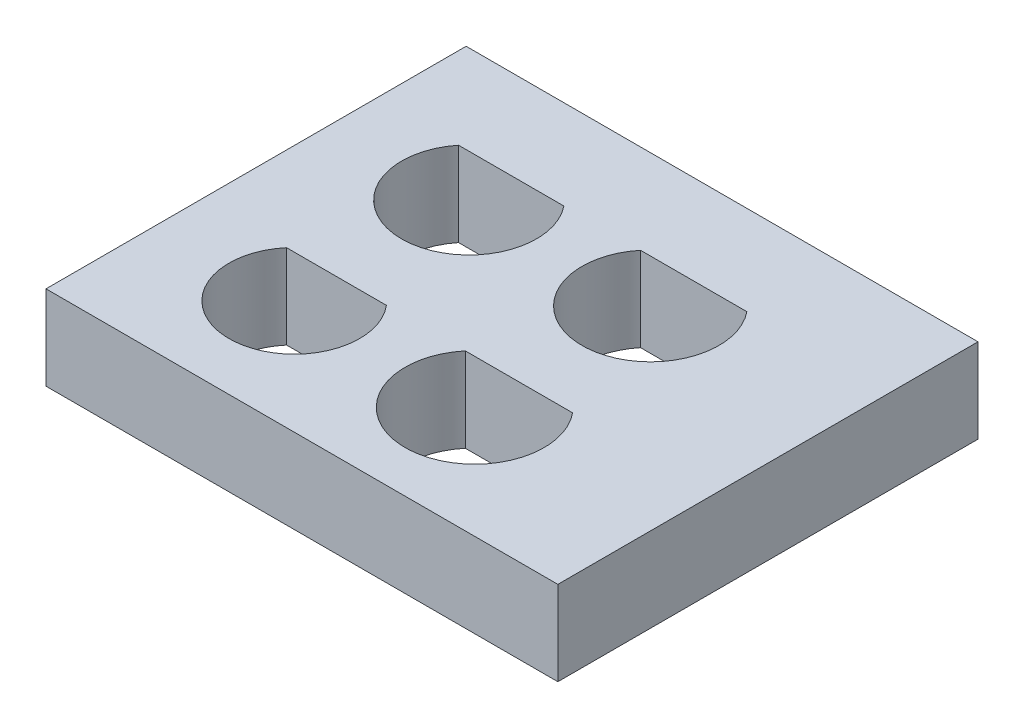
from build123d import *

# Parameters (mm, degrees)
SKETCH1_W           = 12.136372274
SKETCH1_H           = 9.961646607
BOSS_EXTRUDE2_DEPTH = 2


with BuildPart() as part:
    # Sketch1 → Boss-Extrude2 (new body)
    with BuildSketch(Plane(origin=(0, 0, 0), x_dir=(1, 0, 0), z_dir=(0, 1, 0))):
        with Locations((2.877549337, 2.284027555)):
            Rectangle(SKETCH1_W, SKETCH1_H)
        with BuildLine():
            Line((-1.184271928, 1), (1.184271928, 1))
            ThreePointArc((1.184271928, 1), (0, -1.55), (-1.184271928, 1))
        make_face(mode=Mode.SUBTRACT)
        with BuildLine():
            Line((3.05341377, 1), (5.598998182, 1))
            ThreePointArc((5.598998182, 1), (4.326205976, -1.7), (3.05341377, 1))
        make_face(mode=Mode.SUBTRACT)
        with BuildLine():
            Line((-1.2489996, 5.143134086), (1.2489996, 5.143134086))
            ThreePointArc((1.2489996, 5.143134086), (0, 2.543134086), (-1.2489996, 5.143134086))
        make_face(mode=Mode.SUBTRACT)
        with BuildLine():
            Line((3.065253955, 5.143134086), (5.587157997, 5.143134086))
            ThreePointArc((5.587157997, 5.143134086), (4.326205976, 2.493134086), (3.065253955, 5.143134086))
        make_face(mode=Mode.SUBTRACT)
    extrude(amount=BOSS_EXTRUDE2_DEPTH)


solid = part.part
